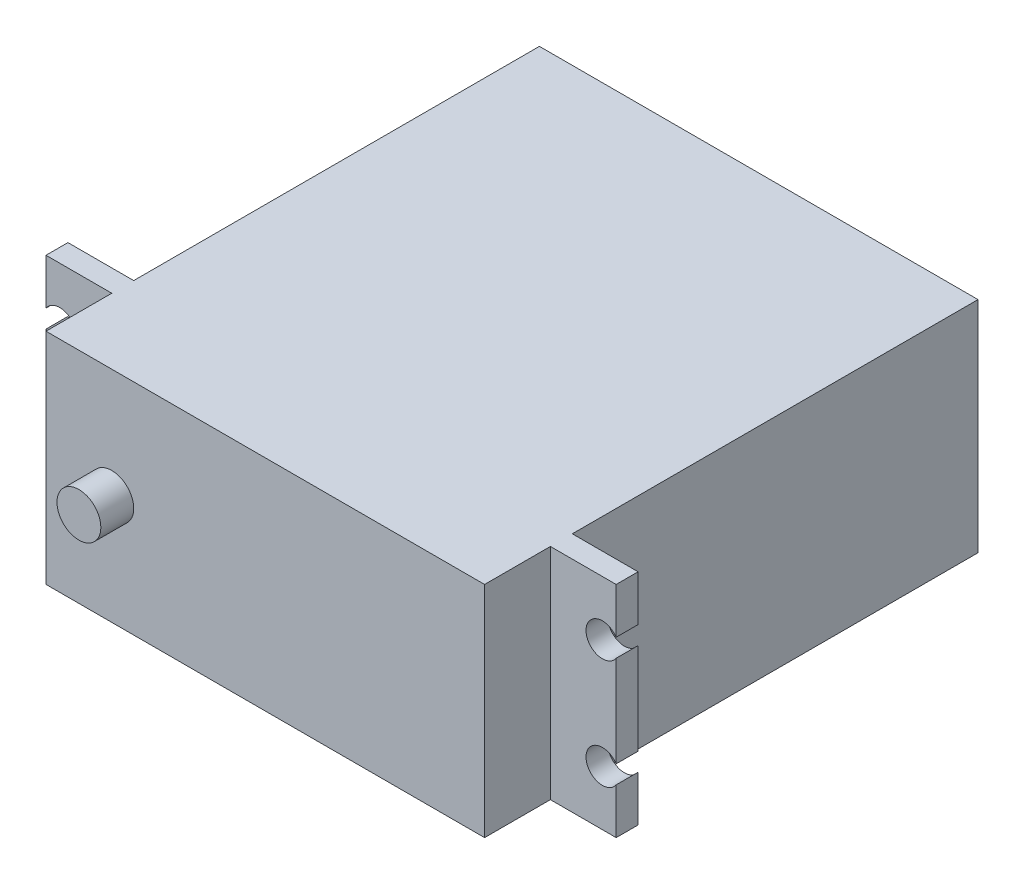
from build123d import *

# Parameters (mm, degrees)
ESQUISSE1_W             = 40
ESQUISSE1_H             = 20
BOSS_EXTRU_1_DEPTH      = 45
ESQUISSE2_R             = 2
BOSS_EXTRU_2_DEPTH      = 3
ESQUISSE3_W             = 2
ESQUISSE3_H             = 20
BOSS_EXTRU_3_DEPTH      = 6
ESQUISSE4_W             = 2
ESQUISSE4_H             = 20
BOSS_EXTRU_4_DEPTH      = 6
ESQUISSE5_R             = 1.5
ENL_V_MAT_EXTRU_1_DEPTH = 6


with BuildPart() as part:
    # Esquisse1 → Boss.-Extru.1 (new body)
    with BuildSketch(Plane.XY):
        with Locations((20, 10)):
            Rectangle(ESQUISSE1_W, ESQUISSE1_H)
    extrude(amount=BOSS_EXTRU_1_DEPTH)

    # Esquisse2 → Boss.-Extru.2 (add)
    with BuildSketch(Plane.XY.offset(45)):
        with Locations(Location((6, 10, 0), (0, 0, 180))):
            Circle(ESQUISSE2_R)
    extrude(amount=BOSS_EXTRU_2_DEPTH)

    # Esquisse3 → Boss.-Extru.3 (add)
    with BuildSketch(Plane.ZY):
        with Locations((38, 10)):
            Rectangle(ESQUISSE3_W, ESQUISSE3_H)
    extrude(amount=BOSS_EXTRU_3_DEPTH)

    # Esquisse4 → Boss.-Extru.4 (add)
    with BuildSketch(Plane(origin=(40, 0, 0), x_dir=(0, 0, -1), z_dir=(1, 0, 0))):
        with Locations((-38, 10)):
            Rectangle(ESQUISSE4_W, ESQUISSE4_H)
    extrude(amount=BOSS_EXTRU_4_DEPTH)

    # Esquisse5 → Enlèv. mat.-Extru.1 (cut)
    with BuildSketch(Plane.XY.offset(39)):
        with Locations((-4.75, 15)):
            Circle(ESQUISSE5_R)
        with Locations((44.75, 15)):
            Circle(ESQUISSE5_R)
        with Locations((44.75, 5)):
            Circle(ESQUISSE5_R)
        with Locations((-4.75, 5)):
            Circle(ESQUISSE5_R)
    extrude(amount=-ENL_V_MAT_EXTRU_1_DEPTH, mode=Mode.SUBTRACT)


solid = part.part
